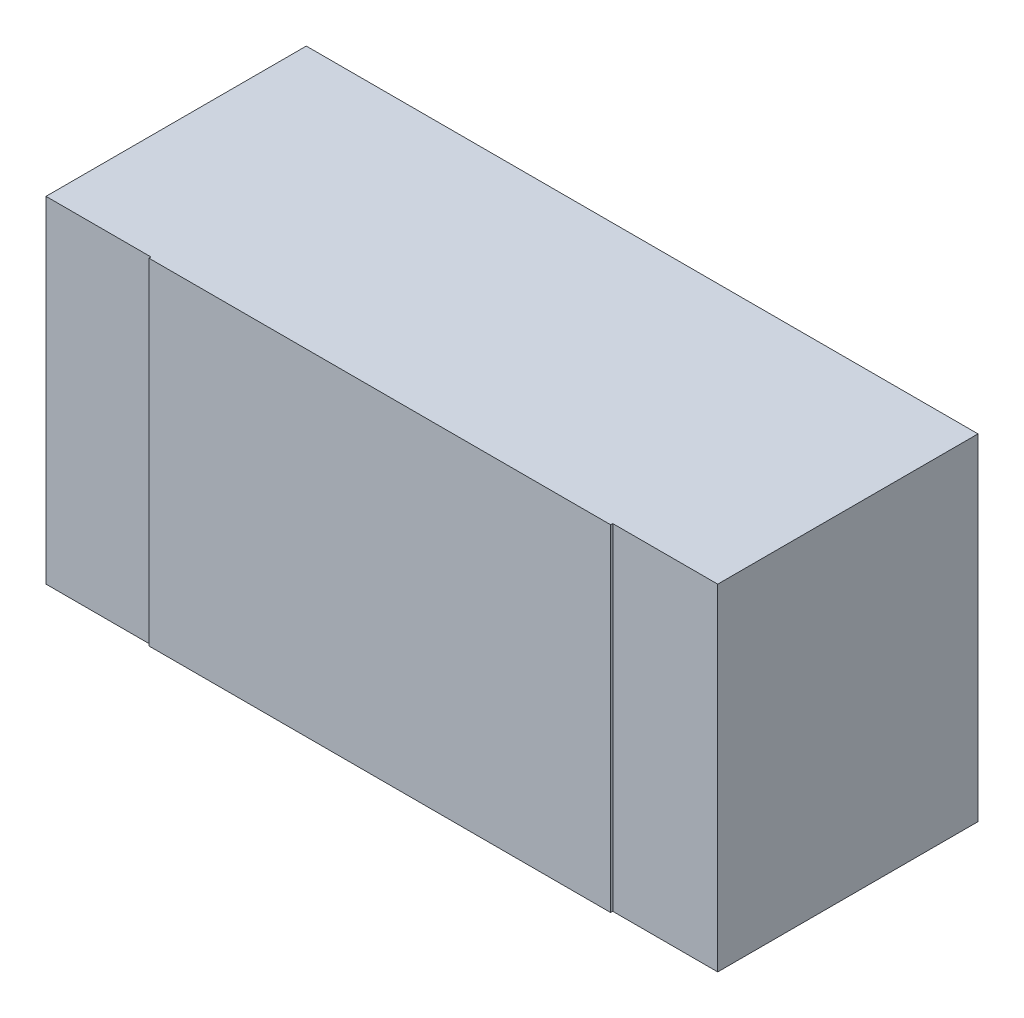
from build123d import *

# Parameters (mm, degrees)
SKETCH_2_W          = 3.2
SKETCH_2_H          = 1.6
EXTRUDE_1_DEPTH     = 1.25
SKETCH_3_W          = 0.5
SKETCH_3_H          = 1.6
CUT_EXTRUDE_1_DEPTH = 0.01


with BuildPart() as part:
    # Эскиз2 → Вытянуть1 (new body)
    with BuildSketch(Plane.XY):
        with Locations((1.3, 0)):
            Rectangle(SKETCH_2_W, SKETCH_2_H)
    extrude(amount=EXTRUDE_1_DEPTH)

    # Эскиз3 → Вырез-Вытянуть1 (cut)
    with BuildSketch(Plane.XY.offset(1.25)):
        with Locations((-0.05, 0)):
            Rectangle(SKETCH_3_W, SKETCH_3_H)
        with Locations((2.65, 0)):
            Rectangle(SKETCH_3_W, SKETCH_3_H)
    extrude(amount=-CUT_EXTRUDE_1_DEPTH, mode=Mode.SUBTRACT)


solid = part.part
